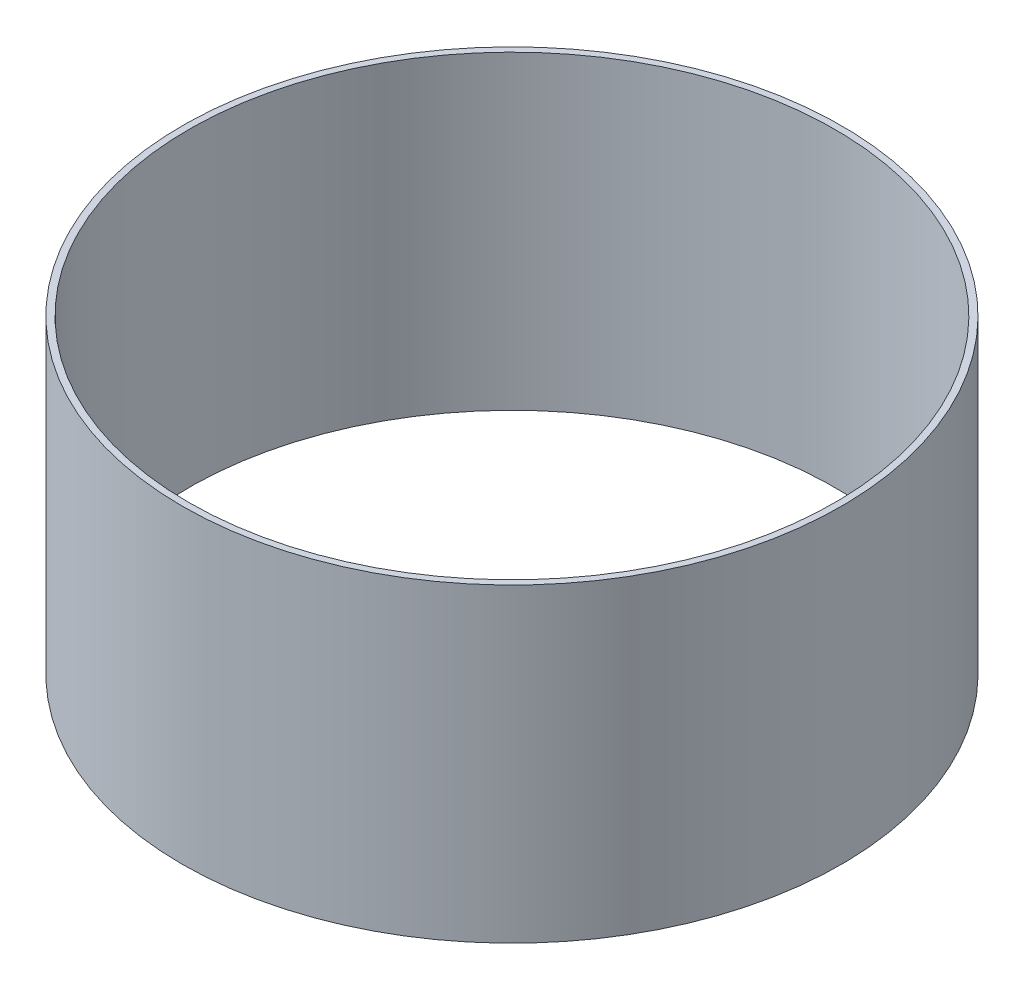
from build123d import *

# Parameters (mm, degrees)
SKETCH_1_R      = 102
SKETCH_1_R_2    = 100
EXTRUDE_1_DEPTH = 96


with BuildPart() as part:
    # Эскиз1 → Бобышка-Вытянуть1 (new body)
    with BuildSketch(Plane(origin=(0, 0, 0), x_dir=(1, 0, 0), z_dir=(0, 1, 0))):
        with Locations(Location((0, 0, 0), (0, 0, 270))):
            Circle(SKETCH_1_R)
        with Locations(Location((0, 0, 0), (0, 0, 270))):
            Circle(SKETCH_1_R_2, mode=Mode.SUBTRACT)
    extrude(amount=-EXTRUDE_1_DEPTH)


solid = part.part
